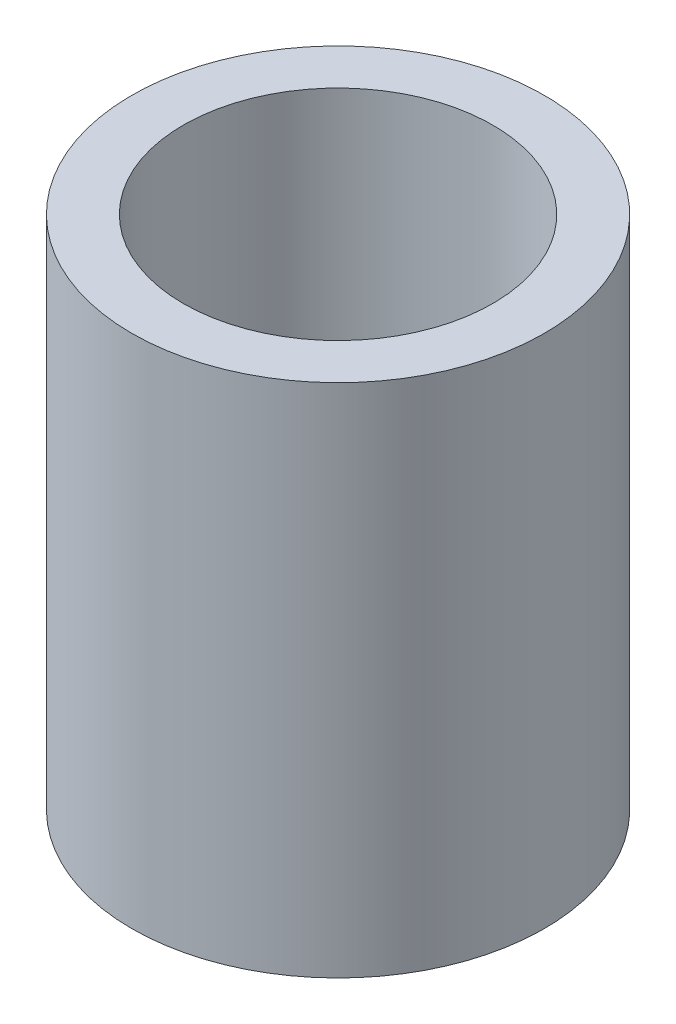
from build123d import *

# Parameters (mm, degrees)
SKETCH2_R           = 10.16
BOSS_EXTRUDE1_DEPTH = 25.4
SKETCH3_R           = 7.62
CUT_EXTRUDE1_DEPTH  = 20.32
SKETCH4_R           = 0.889
CUT_EXTRUDE2_DEPTH  = 3.048
CHAMFER1_SIZE       = 0.381
CHAMFER2_SIZE       = 0.2159
CHAMFER2_SIZE2      = 0.805749769


with BuildPart() as part:
    # Sketch2 → Boss-Extrude1 (new body)
    with BuildSketch(Plane(origin=(0, 0, 0), x_dir=(1, 0, 0), z_dir=(0, 1, 0))):
        with Locations(Location((0, 0, 0), (0, 0, 270))):
            Circle(SKETCH2_R)
    extrude(amount=BOSS_EXTRUDE1_DEPTH)

    # Sketch3 → Cut-Extrude1 (cut)
    with BuildSketch(Plane(origin=(0, 25.4, 0), x_dir=(1, 0, 0), z_dir=(0, 1, 0))):
        with Locations(Location((0, 0, 0), (0, 0, 270))):
            Circle(SKETCH3_R)
    extrude(amount=-CUT_EXTRUDE1_DEPTH, mode=Mode.SUBTRACT)

    # Sketch4 → Cut-Extrude2 (cut)
    with BuildSketch(Plane.XZ):
        with Locations(Location((0, 0, 0), (0, 0, 270))):
            Circle(SKETCH4_R)
    extrude(amount=-CUT_EXTRUDE2_DEPTH, mode=Mode.SUBTRACT)

    # Chamfer1
    chamfer1_edges = [part.edges().sort_by_distance(p)[0] for p in [
        (0, 0, 0.889),
    ]]
    chamfer(chamfer1_edges, length=CHAMFER1_SIZE)

    # Chamfer2
    chamfer2_edges = [part.edges().sort_by_distance(p)[0] for p in [
        (0, 3.048, 0.889),
    ]]
    chamfer2_side = [part.faces().sort_by_distance(p)[0] for p in [
        (0, 1.7145, 0.889),
    ]]
    chamfer(chamfer2_edges, length=CHAMFER2_SIZE, length2=CHAMFER2_SIZE2, reference=chamfer2_side[0])


solid = part.part
